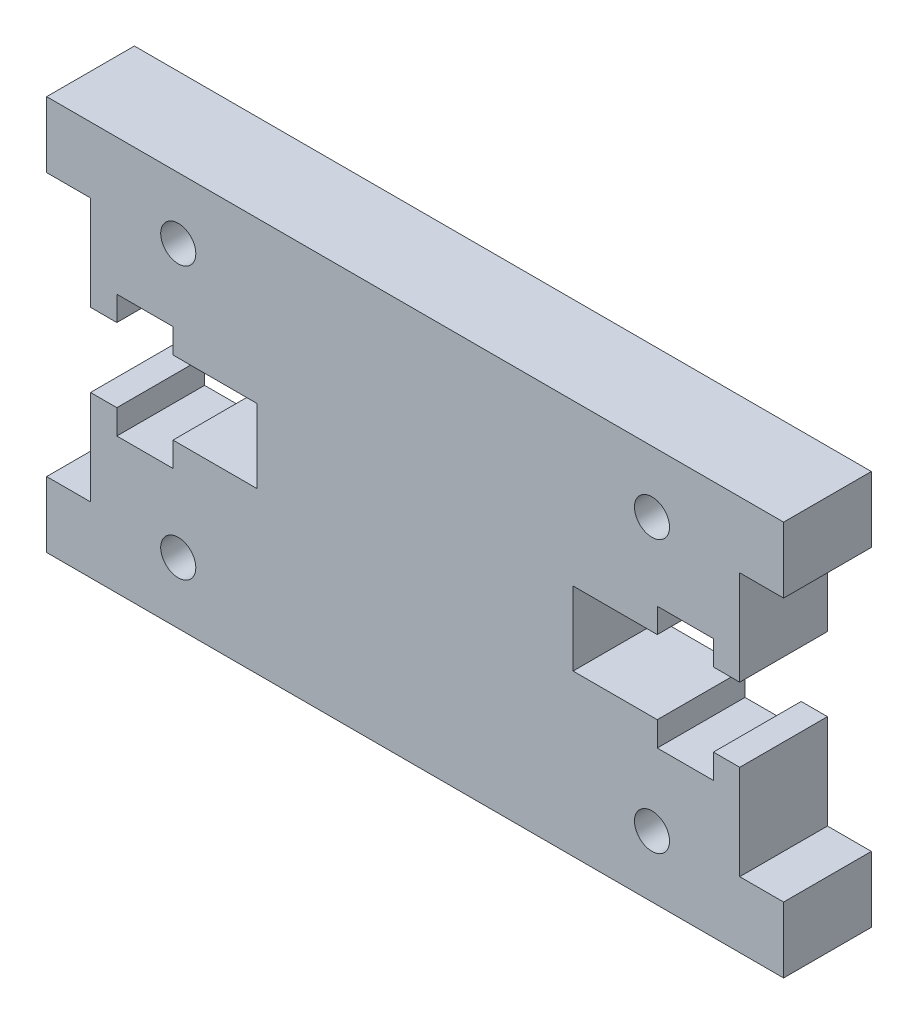
from build123d import *

# Parameters (mm, degrees)
ESQUISSE1_R        = 1
BOSS_EXTRU_1_DEPTH = 5


with BuildPart() as part:
    # Esquisse1 → Boss.-Extru.1 (new body)
    with BuildSketch(Plane.XY):
        Polygon((-7.2, 14.75), (-4, 14.75), (-4, 13.35), (-2.5, 13.35), (-2.5, 18.75), (0, 18.75), (0, 22.5), (-42, 22.5), (-42, 18.75), (-39.5, 18.75), (-39.5, 13.35), (-38, 13.35), (-38, 14.75), (-34.8, 14.75), (-34.8, 13.35), (-30, 13.35), (-30, 9.15), (-34.8, 9.15), (-34.8, 7.75), (-38, 7.75), (-38, 9.15), (-39.5, 9.15), (-39.5, 3.75), (-42, 3.75), (-42, 0), (0, 0), (0, 3.75), (-2.5, 3.75), (-2.5, 9.15), (-4, 9.15), (-4, 7.75), (-7.2, 7.75), (-7.2, 9.15), (-12, 9.15), (-12, 13.35), (-7.2, 13.35), align=None)
        with Locations((-34.5, 3.5)):
            Circle(ESQUISSE1_R, mode=Mode.SUBTRACT)
        with Locations((-7.5, 3.5)):
            Circle(ESQUISSE1_R, mode=Mode.SUBTRACT)
        with Locations((-34.5, 19)):
            Circle(ESQUISSE1_R, mode=Mode.SUBTRACT)
        with Locations((-7.5, 19)):
            Circle(ESQUISSE1_R, mode=Mode.SUBTRACT)
    extrude(amount=BOSS_EXTRU_1_DEPTH)


solid = part.part
